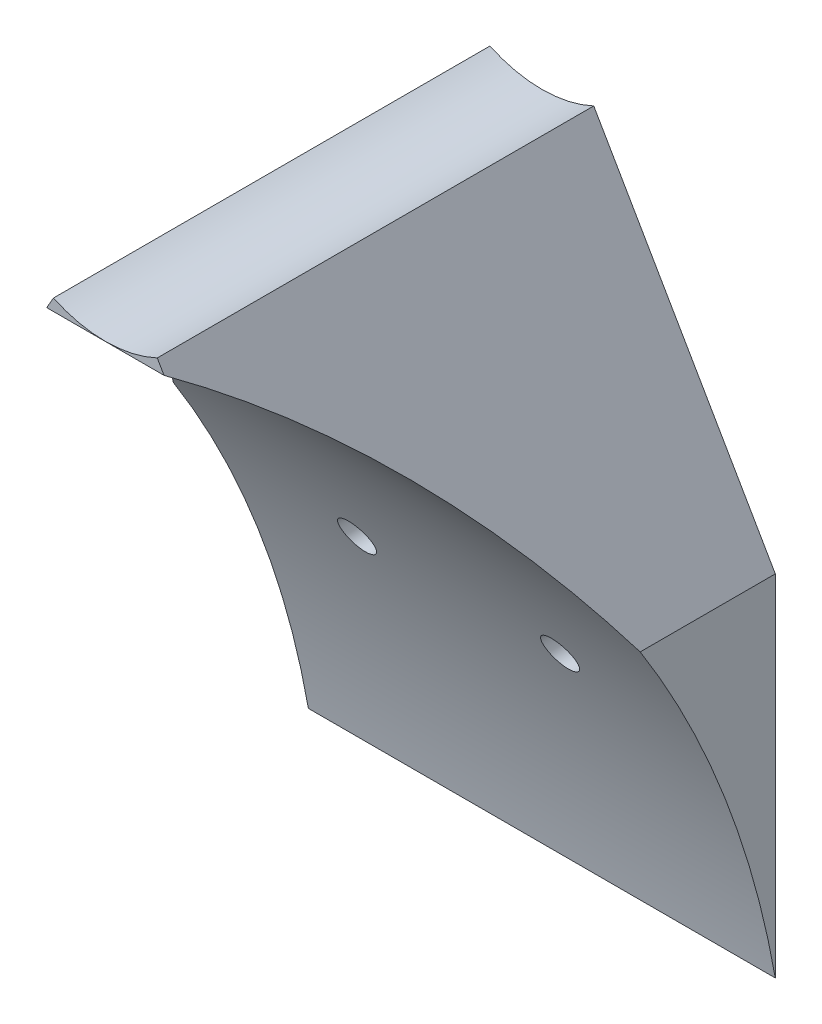
from build123d import *

# Parameters (mm, degrees)
BOSS_EXTRUDE1_DEPTH  = 76.2
CUT_EXTRUDE1_START   = -36.5125
CUT_EXTRUDE1_DEPTH   = 73.025
M5_CLEARANCE_HOLE1_D = 5.5
CUT_EXTRUDE2_REACH   = 145.772
SKETCH10_R           = 19.05


with BuildPart() as part:
    # Sketch1 → Boss-Extrude1 (new body)
    with BuildSketch(Plane.XY):
        Polygon((36.5125, -121.15027858), (36.5125, -66.416505111), (0, -3.175), (-36.5125, -66.416505111), (-36.5125, -121.15027858), align=None)
    extrude(amount=BOSS_EXTRUDE1_DEPTH)

    # Sketch2 → Cut-Extrude1 (cut)
    with BuildSketch(Plane(origin=(0, 0, 0), x_dir=(0, 0, -1), z_dir=(1, 0, 0)).offset(CUT_EXTRUDE1_START)):
        with BuildLine():
            Line((-76.2, -121.15027858), (0, -121.15027858))
            ThreePointArc((0, -121.15027858), (-23.393988511, -62.928903921), (-68.2625, -19.067487592))
            Line((-68.2625, -19.067487592), (-68.2625, -3.175))
            Line((-68.2625, -3.175), (-76.2, -3.175))
            Line((-76.2, -3.175), (-76.2, -22.225))
            Line((-76.2, -22.225), (-76.2, -66.416505111))
            Line((-76.2, -66.416505111), (-76.2, -121.15027858))
        make_face()
    extrude(amount=CUT_EXTRUDE1_DEPTH, mode=Mode.SUBTRACT)

    # M5 Clearance Hole1 (through all)
    with Locations(Plane(origin=(0, 0, 0), x_dir=(-1, 0, 0), z_dir=(0, 0, -1))):
        with Locations((-15.875, -81.009177721), (15.875, -81.009177721), (0, -38.1)):
            Hole(M5_CLEARANCE_HOLE1_D / 2)

    # Sketch10 → Cut-Extrude2 (cut, up to next)
    with BuildSketch(Plane(origin=(0, 0, 0), x_dir=(-1, 0, 0), z_dir=(0, 0, -1)), mode=Mode.PRIVATE) as cut_extrude2_sk1:
        Circle(SKETCH10_R)
    cut_extrude2_tool1 = extrude(cut_extrude2_sk1.sketch, amount=-CUT_EXTRUDE2_REACH, mode=Mode.PRIVATE) & part.part
    add(cut_extrude2_tool1.solids().sort_by_distance((0, 0, 0))[0], mode=Mode.SUBTRACT)


solid = part.part
